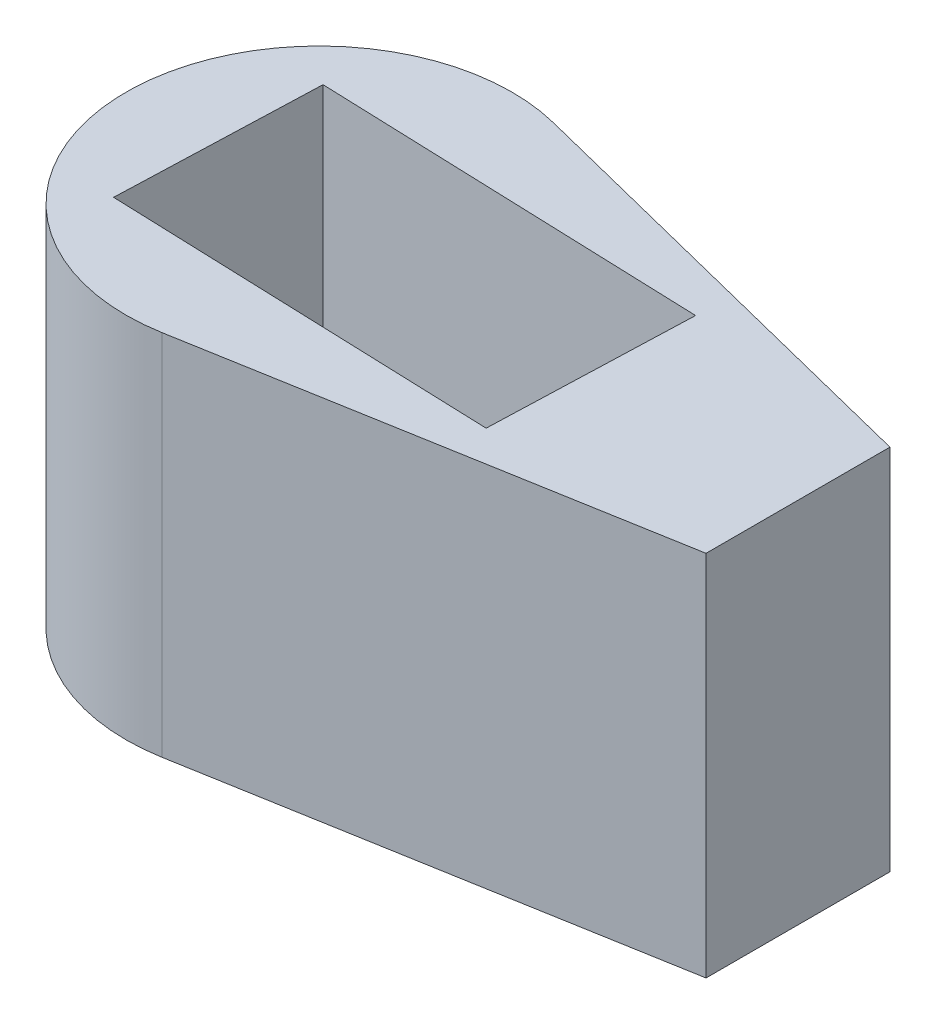
from build123d import *

# Parameters (mm, degrees)
CROQUIS1_R              = 21
SALIENTE_EXTRUIR1_DEPTH = 40
SALIENTE_EXTRUIR2_DEPTH = 40
SALIENTE_EXTRUIR3_REACH = 77.493
CROQUIS3_R              = 13.5
CROQUIS3_R_2            = 10
CROQUIS7_R              = 8.227269221
CROQUIS7_R_2            = 6
CORTAR_EXTRUIR6_DEPTH   = 6
CROQUIS8_R              = 6
CORTAR_EXTRUIR7_DEPTH   = 72.223648425
CORTAR_EXTRUIR8_START   = -25
CORTAR_EXTRUIR8_DEPTH   = 25
CROQUIS12_R             = 9.55
CORTAR_EXTRUIR9_DEPTH   = 5.5


with BuildPart() as part:
    # Croquis1 → Saliente-Extruir1 (new body)
    with BuildSketch(Plane(origin=(0, 0, 0), x_dir=(1, 0, 0), z_dir=(0, 1, 0))):
        with Locations(Location((0, 0, 0), (0, 0, 270))):
            Circle(CROQUIS1_R)
    extrude(amount=SALIENTE_EXTRUIR1_DEPTH)

    # Croquis2 → Saliente-Extruir2 (add)
    with BuildSketch(Plane(origin=(0, 0, 0), x_dir=(1, 0, 0), z_dir=(0, 1, 0))):
        with BuildLine():
            Line((53.975127576, 8.110971331), (53.975127576, -11.889028669))
            Line((53.975127576, -11.889028669), (3.613793412, -20.686722727))
            ThreePointArc((3.613793412, -20.686722727), (20.98607707, -0.764571273), (5.109545014, 20.368911354))
            Line((5.109545014, 20.368911354), (53.975127576, 8.110971331))
        make_face()
    extrude(amount=SALIENTE_EXTRUIR2_DEPTH)

    # Croquis3 → Saliente-Extruir3 (add, up to next)
    with BuildSketch(Plane(origin=(5.109545014, 0, -20.368911354), x_dir=(-0.9699481597219111, 0, -0.24331166731597212), z_dir=(0.2433116673159721, 0, -0.969948159721911)), mode=Mode.PRIVATE) as saliente_extruir3_sk1:
        with Locations((0, 20)):
            Circle(CROQUIS3_R)
        with Locations((0, 20)):
            Circle(CROQUIS3_R_2, mode=Mode.SUBTRACT)
    saliente_extruir3_tool1 = extrude(saliente_extruir3_sk1.sketch, amount=-SALIENTE_EXTRUIR3_REACH, mode=Mode.PRIVATE) - part.part
    add(saliente_extruir3_tool1.solids().sort_by_distance((17.833482, 20, -17.177109))[0])

    # Croquis7 → Cortar-Extruir6 (cut)
    with BuildSketch(Plane.XZ):
        with Locations(Location((0, 0, 0), (0, 0, 270))):
            Circle(CROQUIS7_R)
        with Locations(Location((0, 0, 0), (0, 0, 270))):
            Circle(CROQUIS7_R_2, mode=Mode.SUBTRACT)
    extrude(amount=-CORTAR_EXTRUIR6_DEPTH, mode=Mode.SUBTRACT)

    # Croquis8 → Cortar-Extruir7 (cut, through all)
    with BuildSketch(Plane.XZ):
        with Locations(Location((0, 0, 0), (0, 0, 270))):
            Circle(CROQUIS8_R)
    extrude(amount=-CORTAR_EXTRUIR7_DEPTH, mode=Mode.SUBTRACT)

    # Croquis10 → Cortar-Extruir8 (cut)
    with BuildSketch(Plane(origin=(0, 40, 0), x_dir=(1, 0, 0), z_dir=(0, 1, 0)).offset(CORTAR_EXTRUIR8_START)):
        with BuildLine():
            Line((-5.995438853, 0.23390802), (-11.37823559, 0.424457107))
            Line((-11.37823559, 0.424457107), (-11.767631672, -10.575542893))
            Line((-11.767631672, -10.575542893), (30.232368328, -12.062327932))
            Line((30.232368328, -12.062327932), (30.62176441, -1.062327932))
            Line((30.62176441, -1.062327932), (5.996971268, -0.190619027))
            ThreePointArc((5.996971268, -0.190619027), (-0.212264906, -5.996244125), (-5.995438853, 0.23390802))
        make_face()
        with BuildLine():
            Line((-10.988839509, 11.424457107), (-11.37823559, 0.424457107))
            Line((-11.37823559, 0.424457107), (-5.995438853, 0.23390802))
            ThreePointArc((-5.995438853, 0.23390802), (0.116976243, 5.998859605), (6, 0))
            ThreePointArc((6, 0), (5.999242769, -0.095321543), (5.996971268, -0.190619027))
            Line((5.996971268, -0.190619027), (30.62176441, -1.062327932))
            Line((30.62176441, -1.062327932), (31.011160491, 9.937672068))
            Line((31.011160491, 9.937672068), (-10.988839509, 11.424457107))
        make_face()
    extrude(amount=CORTAR_EXTRUIR8_DEPTH, mode=Mode.SUBTRACT)

    # Croquis12 → Cortar-Extruir9 (cut)
    with BuildSketch(Plane(origin=(0, 15, 0), x_dir=(1, 0, 0), z_dir=(0, 1, 0))):
        with Locations(Location((0, 0, 0), (0, 0, 270))):
            Circle(CROQUIS12_R)
    extrude(amount=-CORTAR_EXTRUIR9_DEPTH, mode=Mode.SUBTRACT)


solid = part.part
